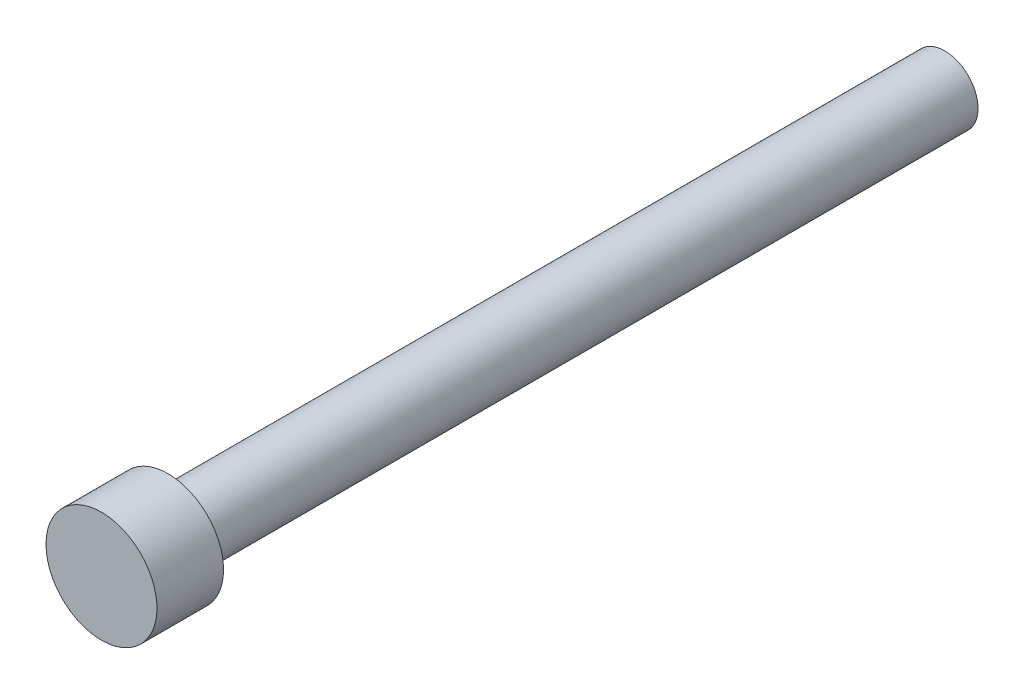
from build123d import *


with BuildPart() as part:
    # Sketch1 → REV_ISO4762_M6x70_8.8 (revolve)
    with BuildSketch(Plane(origin=(0, 0, 0), x_dir=(1, 0, 0), z_dir=(0, 1, 0)), mode=Mode.PRIVATE) as rev_iso4762_m6x70_8_8_sk:
        Polygon((0, -6), (5, -6), (5, 0), (3, 0), (3, 70), (0, 70), align=None)
    revolve(rev_iso4762_m6x70_8_8_sk.sketch.rotate(Axis((0, 0, -70), (0, 0, 1)), 180), axis=Axis((0, 0, -70), (0, 0, 1)))


solid = part.part
